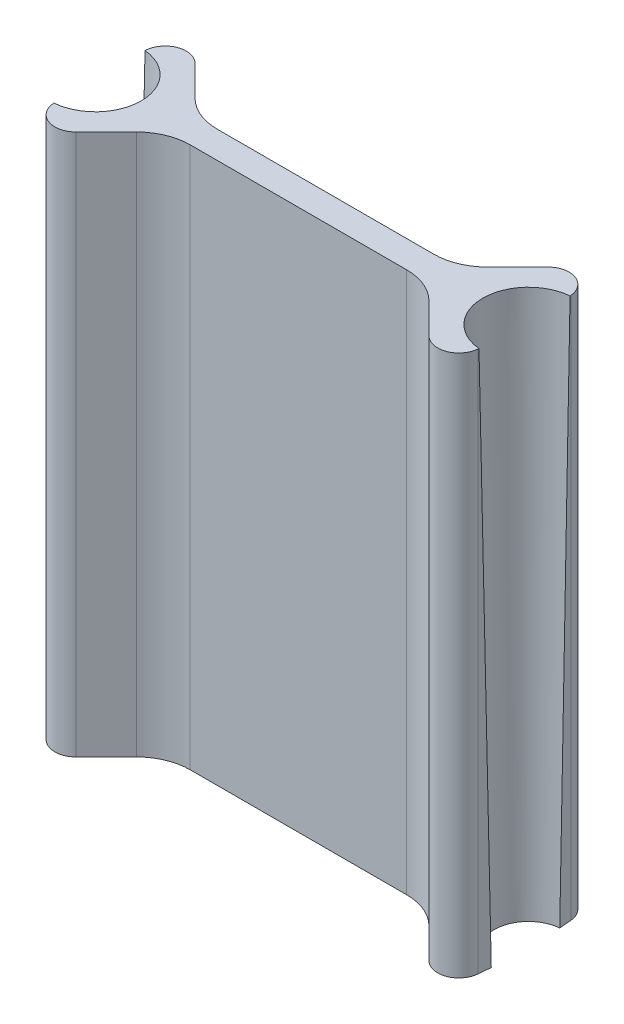
from build123d import *

# Parameters (mm, degrees)
BOSS_EXTRUDE2_DEPTH          = 10
SKETCH5_R                    = 0.635
CUT_EXTRUDE1_DEPTH           = 10
CUT_EXTRUDE1_DRAFT           = 1.2
CUT_EXTRUDE1_PROFILE_2_DEPTH = 10
CUT_EXTRUDE1_PROFILE_2_DRAFT = 1.2


with BuildPart() as part:
    # Sketch2 → Boss-Extrude2 (new body)
    with BuildSketch(Plane(origin=(0, 0, 0), x_dir=(1, 0, 0), z_dir=(0, 1, 0))):
        with BuildLine():
            Line((0.055343897, 0.632583633), (0.075113859, 0.858555332))
            ThreePointArc((0.075113859, 0.858555332), (0.329887136, 1.190582332), (0.738477631, 1.1))
            Line((0.738477631, 1.1), (1.297487373, 0.540990258))
            ThreePointArc((1.297487373, 0.540990258), (1.619802906, 0.325625904), (2, 0.25))
            Line((2, 0.25), (6, 0.25))
            ThreePointArc((6, 0.25), (6.380197094, 0.325625904), (6.702512627, 0.540990258))
            Line((6.702512627, 0.540990258), (7.261522369, 1.1))
            ThreePointArc((7.261522369, 1.1), (7.670112864, 1.190582332), (7.924886141, 0.858555332))
            Line((7.924886141, 0.858555332), (7.944656103, 0.632583633))
            Line((7.944656103, 0.632583633), (7.944656103, -0.632583633))
            Line((7.944656103, -0.632583633), (7.924886141, -0.858555332))
            ThreePointArc((7.924886141, -0.858555332), (7.670112864, -1.190582332), (7.261522369, -1.1))
            Line((7.261522369, -1.1), (6.702512627, -0.540990258))
            ThreePointArc((6.702512627, -0.540990258), (6.380197094, -0.325625904), (6, -0.25))
            Line((6, -0.25), (2, -0.25))
            ThreePointArc((2, -0.25), (1.619802906, -0.325625904), (1.297487373, -0.540990258))
            Line((1.297487373, -0.540990258), (0.738477631, -1.1))
            ThreePointArc((0.738477631, -1.1), (0.329887136, -1.190582332), (0.075113859, -0.858555332))
            Line((0.075113859, -0.858555332), (0.055343897, -0.632583633))
            Line((0.055343897, -0.632583633), (0.055343897, 0.632583633))
        make_face()
    extrude(amount=BOSS_EXTRUDE2_DEPTH)


with BuildPart() as cut_extrude1_tool:
    # Sketch5 → Cut-Extrude1 (with draft: the straight prism first)
    with BuildSketch(Plane.XZ):
        Circle(SKETCH5_R)
    extrude(amount=-CUT_EXTRUDE1_DEPTH)
    # Cut-Extrude1: the draft: its side faces are tilted about the plane it starts from
    cut_extrude1_sides = [cut_extrude1_tool.faces().sort_by_distance(p)[0] for p in [
        (-0.635, 5, 0),
    ]]
    draft(cut_extrude1_sides, Plane.XZ, CUT_EXTRUDE1_DRAFT)


with BuildPart() as part_1:
    add(part.part)

    # Cut-Extrude1: cut by cut_extrude1_tool
    add(cut_extrude1_tool.part, mode=Mode.SUBTRACT)


with BuildPart() as cut_extrude1_profile_2_tool:
    # Sketch5 → Cut-Extrude1 profile 2 (with draft: the straight prism first)
    with BuildSketch(Plane.XZ):
        with Locations((8, 0)):
            Circle(SKETCH5_R)
    extrude(amount=-CUT_EXTRUDE1_PROFILE_2_DEPTH)
    # Cut-Extrude1 profile 2: the draft: its side faces are tilted about the plane it starts from
    cut_extrude1_profile_2_sides = [cut_extrude1_profile_2_tool.faces().sort_by_distance(p)[0] for p in [
        (7.365, 5, 0),
    ]]
    draft(cut_extrude1_profile_2_sides, Plane.XZ, CUT_EXTRUDE1_PROFILE_2_DRAFT)


with BuildPart() as part_2:
    add(part_1.part)

    # Cut-Extrude1 profile 2: cut by cut_extrude1_profile_2_tool
    add(cut_extrude1_profile_2_tool.part, mode=Mode.SUBTRACT)


solid = part_2.part
